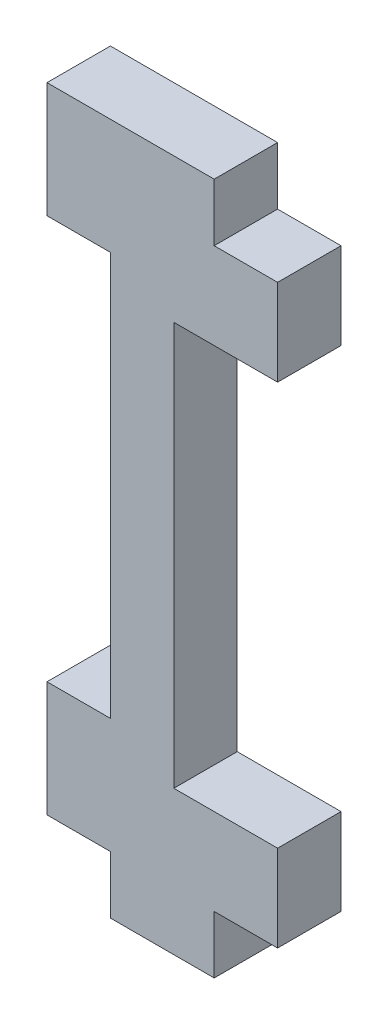
from build123d import *

# Parameters (mm, degrees)
SKETCH_1_W          = 20
SKETCH_1_H          = 60
EXTRUDE_1_DEPTH     = 5.5
SKETCH_3_W          = 5.5
SKETCH_3_H          = 35
SKETCH_3_H_2        = 5
SKETCH_3_W_2        = 9
CUT_EXTRUDE_1_DEPTH = 62.075772611


with BuildPart() as part:
    # ｽｹｯﾁ1 → ﾎﾞｽ - 押し出し1 (new body)
    with BuildSketch(Plane.XY):
        with Locations((0, -30)):
            Rectangle(SKETCH_1_W, SKETCH_1_H)
    extrude(amount=EXTRUDE_1_DEPTH)

    # ｽｹｯﾁ3 → ｶｯﾄ - 押し出し1 (cut, through all)
    with BuildSketch(Plane.XY.offset(5.5)):
        with Locations((-7.25, -27.5)):
            Rectangle(SKETCH_3_W, SKETCH_3_H)
        with Locations((-7.25, -57.5)):
            Rectangle(SKETCH_3_W, SKETCH_3_H_2)
        with Locations((5.5, -30)):
            Rectangle(SKETCH_3_W_2, SKETCH_3_H)
        with Locations((7.25, -57.5)):
            Rectangle(SKETCH_3_W, SKETCH_3_H_2)
        with Locations((7.25, -2.5)):
            Rectangle(SKETCH_3_W, SKETCH_3_H_2)
    extrude(amount=-CUT_EXTRUDE_1_DEPTH, mode=Mode.SUBTRACT)


solid = part.part
